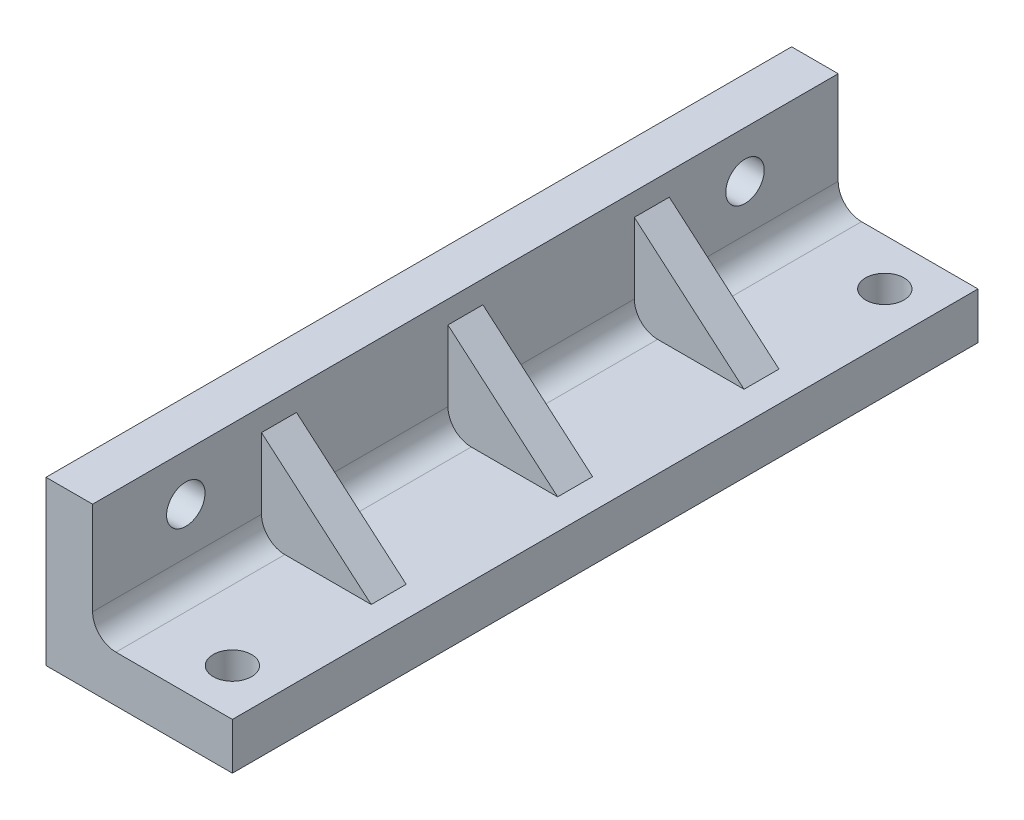
from build123d import *

# Parameters (mm, degrees)
F_1P5MM_64_START              = -32
F_1P5MM_64_DEPTH              = 64
CUT_EXTRUDE_M3_1_DEPTH        = 100
CUT_EXTRUDE_M3_1_DEPTH_BACK   = 100
SKETCH_2_R                    = 1.65
CUT_EXTRUDE_M3_1_2_DEPTH      = 100
CUT_EXTRUDE_M3_1_2_DEPTH_BACK = 100
SKETCH_4_R                    = 1.65
CUT_EXTRUDE_M3_1_3_DEPTH      = 100
CUT_EXTRUDE_M3_1_3_DEPTH_BACK = 100
SKETCH_5_R                    = 1.65
CUT_EXTRUDE_M3_1_4_DEPTH      = 100
CUT_EXTRUDE_M3_1_4_DEPTH_BACK = 100
SKETCH_7_R                    = 1.65
FDM_R2_R                      = 2
FDM_3MM_16_START              = -17.5
FDM_3MM_16_DEPTH              = 3
FDM_3MM_0_START               = -1.5
FDM_3MM_0_DEPTH               = 3
FDM_3MM_16_START_2            = 14.5
FDM_3MM_16_2_DEPTH            = 3


with BuildPart() as part:
    # 草图1 → 1p5mm铝合金直角座_宽64 (new body)
    with BuildSketch(Plane.XY.offset(F_1P5MM_64_START)):
        Polygon((0, 0), (16, 0), (16, 4), (4, 4), (4, 14), (0, 14), align=None)
    extrude(amount=F_1P5MM_64_DEPTH)

    # 草图2 → Cut-Extrude M3_-1 (cut, two sides: drawn at the far end of the back side and taken through both)
    with BuildSketch(Plane(origin=(0, 0, 0), x_dir=(0, 0, -1), z_dir=(1, 0, 0)).offset(-CUT_EXTRUDE_M3_1_DEPTH_BACK)):
        with Locations((24, 10)):
            Circle(SKETCH_2_R)
    extrude(amount=CUT_EXTRUDE_M3_1_DEPTH + CUT_EXTRUDE_M3_1_DEPTH_BACK, mode=Mode.SUBTRACT)

    # 草图4 → Cut-Extrude M3_-1 2 (cut, two sides: drawn at the far end of the back side and taken through both)
    with BuildSketch(Plane(origin=(0, 0, 0), x_dir=(1, 0, 0), z_dir=(0, 1, 0)).offset(-CUT_EXTRUDE_M3_1_2_DEPTH_BACK)):
        with Locations(Location((12, 28, 0), (0, 0, 270))):
            Circle(SKETCH_4_R)
    extrude(amount=CUT_EXTRUDE_M3_1_2_DEPTH + CUT_EXTRUDE_M3_1_2_DEPTH_BACK, mode=Mode.SUBTRACT)

    # 草图5 → Cut-Extrude M3_1 3 (cut, two sides: drawn at the far end of the back side and taken through both)
    with BuildSketch(Plane(origin=(0, 0, 0), x_dir=(0, 0, -1), z_dir=(1, 0, 0)).offset(-CUT_EXTRUDE_M3_1_3_DEPTH_BACK)):
        with Locations((-24, 10)):
            Circle(SKETCH_5_R)
    extrude(amount=CUT_EXTRUDE_M3_1_3_DEPTH + CUT_EXTRUDE_M3_1_3_DEPTH_BACK, mode=Mode.SUBTRACT)

    # 草图7 → Cut-Extrude M3_1 4 (cut, two sides: drawn at the far end of the back side and taken through both)
    with BuildSketch(Plane(origin=(0, 0, 0), x_dir=(1, 0, 0), z_dir=(0, 1, 0)).offset(-CUT_EXTRUDE_M3_1_4_DEPTH_BACK)):
        with Locations(Location((12, -28, 0), (0, 0, 270))):
            Circle(SKETCH_7_R)
    extrude(amount=CUT_EXTRUDE_M3_1_4_DEPTH + CUT_EXTRUDE_M3_1_4_DEPTH_BACK, mode=Mode.SUBTRACT)

    # FDM根部内圆角_R2
    fdm_r2_edges = [part.edges().sort_by_distance(p)[0] for p in [
        (4, 4, 0),
    ]]
    fillet(fdm_r2_edges, radius=FDM_R2_R)

    # 草图8 → FDM__3mm_-16 (add)
    with BuildSketch(Plane.XY.offset(FDM_3MM_16_START)):
        Polygon((3.5, 3.5), (14, 3.5), (3.5, 12.5), align=None)
    extrude(amount=FDM_3MM_16_DEPTH)

    # 草图9 → FDM三角加强筋_3mm_0 (add)
    with BuildSketch(Plane.XY.offset(FDM_3MM_0_START)):
        Polygon((3.5, 3.5), (14, 3.5), (3.5, 12.5), align=None)
    extrude(amount=FDM_3MM_0_DEPTH)

    # 草图10 → FDM__3mm_16 2 (add)
    with BuildSketch(Plane.XY.offset(FDM_3MM_16_START_2)):
        Polygon((3.5, 3.5), (14, 3.5), (3.5, 12.5), align=None)
    extrude(amount=FDM_3MM_16_2_DEPTH)


solid = part.part
